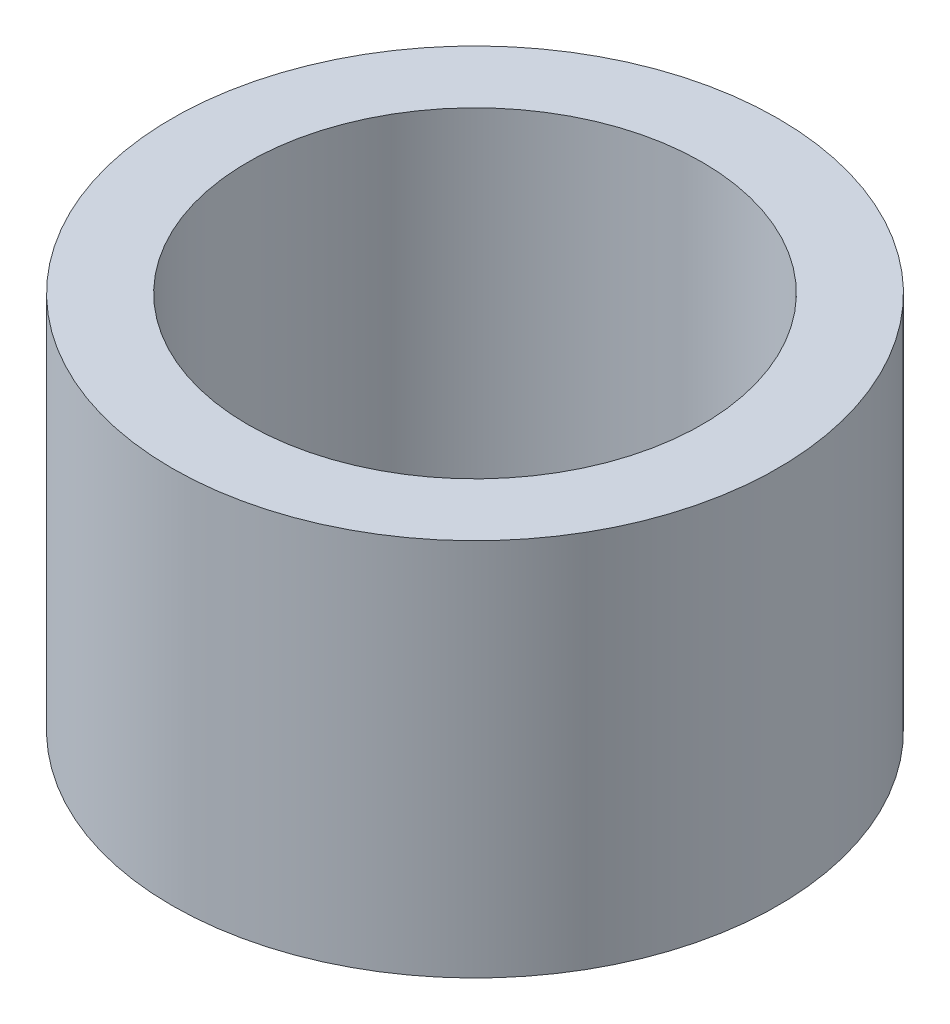
from build123d import *

# Parameters (mm, degrees)
SKETCH1_R           = 2
SKETCH1_R_2         = 1.5
BOSS_EXTRUDE1_DEPTH = 2.5


with BuildPart() as part:
    # Sketch1 → Boss-Extrude1 (new body)
    with BuildSketch(Plane(origin=(0, 0, 0), x_dir=(1, 0, 0), z_dir=(0, 1, 0))):
        with Locations(Location((0, 0, 0), (0, 0, 270))):
            Circle(SKETCH1_R)
        with Locations(Location((0, 0, 0), (0, 0, 270))):
            Circle(SKETCH1_R_2, mode=Mode.SUBTRACT)
    extrude(amount=BOSS_EXTRUDE1_DEPTH)


solid = part.part
